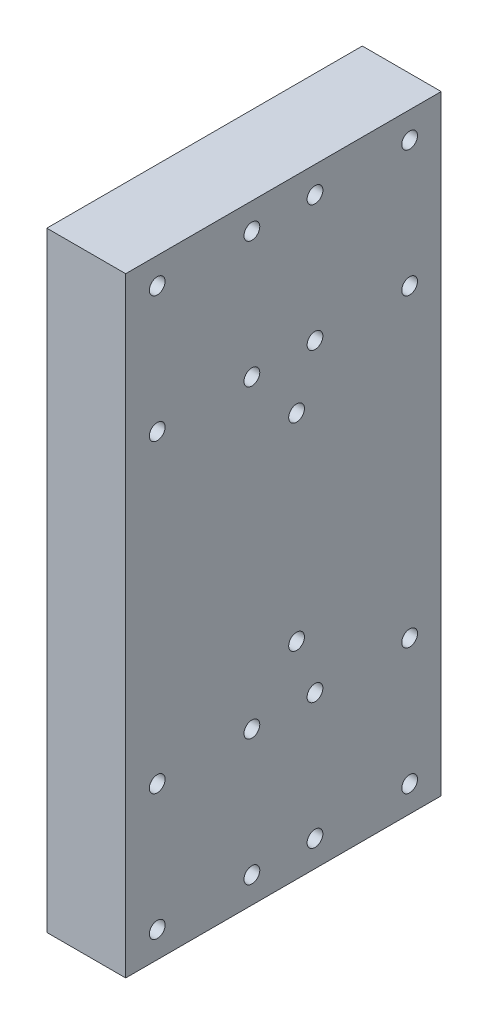
from build123d import *

# Parameters (mm, degrees)
CROQUIS1_W              = 60
CROQUIS1_H              = 116
CROQUIS1_R              = 1.5
SALIENTE_EXTRUIR1_DEPTH = 15


with BuildPart() as part:
    # Croquis1 → Saliente-Extruir1 (new body)
    with BuildSketch(Plane(origin=(0, 0, 0), x_dir=(0, 0, -1), z_dir=(1, 0, 0))):
        with Locations((30, 58)):
            Rectangle(CROQUIS1_W, CROQUIS1_H)
        with Locations((54, 5)):
            Circle(CROQUIS1_R, mode=Mode.SUBTRACT)
        with Locations((36, 5)):
            Circle(CROQUIS1_R, mode=Mode.SUBTRACT)
        with Locations((36, 29)):
            Circle(CROQUIS1_R, mode=Mode.SUBTRACT)
        with Locations((54, 29)):
            Circle(CROQUIS1_R, mode=Mode.SUBTRACT)
        with Locations(Location((24, 29, 0), (0, 0, 180))):
            Circle(CROQUIS1_R, mode=Mode.SUBTRACT)
        with Locations(Location((24, 5, 0), (0, 0, 180))):
            Circle(CROQUIS1_R, mode=Mode.SUBTRACT)
        with Locations(Location((6, 5, 0), (0, 0, 180))):
            Circle(CROQUIS1_R, mode=Mode.SUBTRACT)
        with Locations(Location((6, 29, 0), (0, 0, 180))):
            Circle(CROQUIS1_R, mode=Mode.SUBTRACT)
        with Locations((6, 87)):
            Circle(CROQUIS1_R, mode=Mode.SUBTRACT)
        with Locations((6, 111)):
            Circle(CROQUIS1_R, mode=Mode.SUBTRACT)
        with Locations((24, 111)):
            Circle(CROQUIS1_R, mode=Mode.SUBTRACT)
        with Locations((24, 87)):
            Circle(CROQUIS1_R, mode=Mode.SUBTRACT)
        with Locations(Location((36, 87, 0), (0, 0, 180))):
            Circle(CROQUIS1_R, mode=Mode.SUBTRACT)
        with Locations(Location((36, 111, 0), (0, 0, 180))):
            Circle(CROQUIS1_R, mode=Mode.SUBTRACT)
        with Locations(Location((54, 111, 0), (0, 0, 180))):
            Circle(CROQUIS1_R, mode=Mode.SUBTRACT)
        with Locations(Location((54, 87, 0), (0, 0, 180))):
            Circle(CROQUIS1_R, mode=Mode.SUBTRACT)
        with Locations((32.5, 76.8)):
            Circle(CROQUIS1_R, mode=Mode.SUBTRACT)
        with Locations((32.5, 39.2)):
            Circle(CROQUIS1_R, mode=Mode.SUBTRACT)
    extrude(amount=SALIENTE_EXTRUIR1_DEPTH)


solid = part.part
